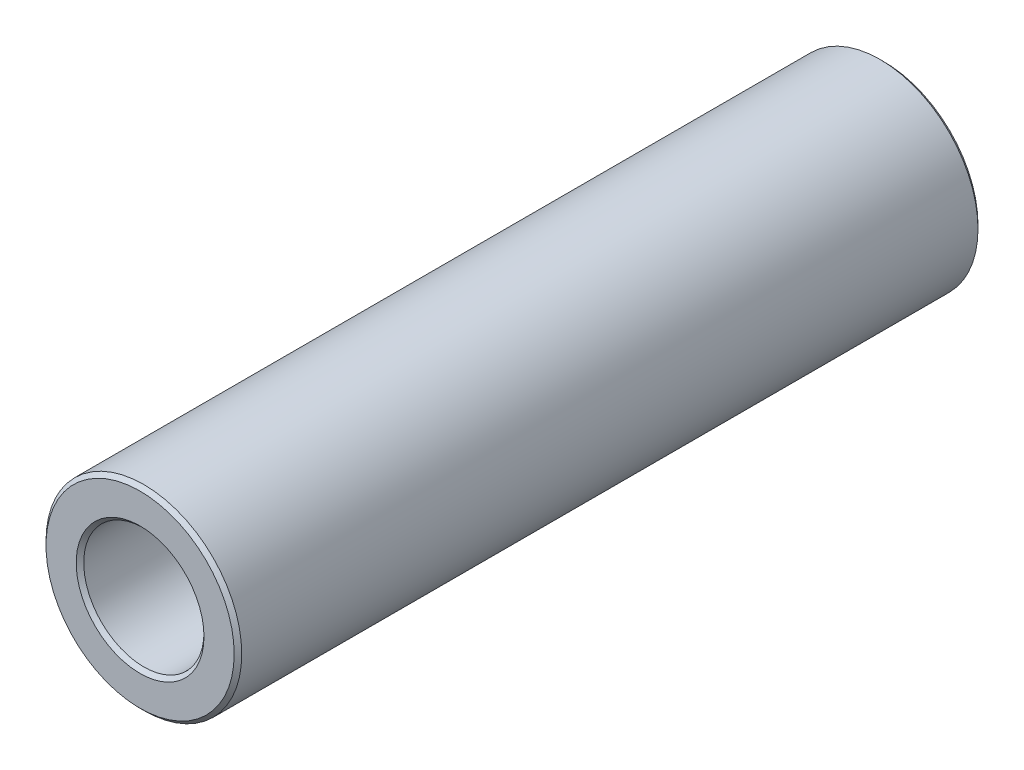
from build123d import *

# Parameters (mm, degrees)
BOSS_EXTRUDE1_DEPTH      = 15.08125
BOSS_EXTRUDE1_DEPTH_BACK = 15.08125
SKETCH3_R                = 3.96875
SKETCH3_R_2              = 2.4384
CHAMFER1_SIZE            = 0.153035


with BuildPart() as part:
    # Sketch3 → Boss-Extrude1 (new, two sides: drawn at the far end of the back side and taken through both)
    with BuildSketch(Plane.XY.offset(-BOSS_EXTRUDE1_DEPTH_BACK)):
        Circle(SKETCH3_R)
        Circle(SKETCH3_R_2, mode=Mode.SUBTRACT)
    extrude(amount=BOSS_EXTRUDE1_DEPTH + BOSS_EXTRUDE1_DEPTH_BACK)

    # Chamfer1
    chamfer1_edges = [part.edges().sort_by_distance(p)[0] for p in [
        (-3.96875, 0, -15.08125),
        (-2.4384, 0, -15.08125),
        (-3.96875, 0, 15.08125),
        (-2.4384, 0, 15.08125),
    ]]
    chamfer(chamfer1_edges, length=CHAMFER1_SIZE)


solid = part.part
